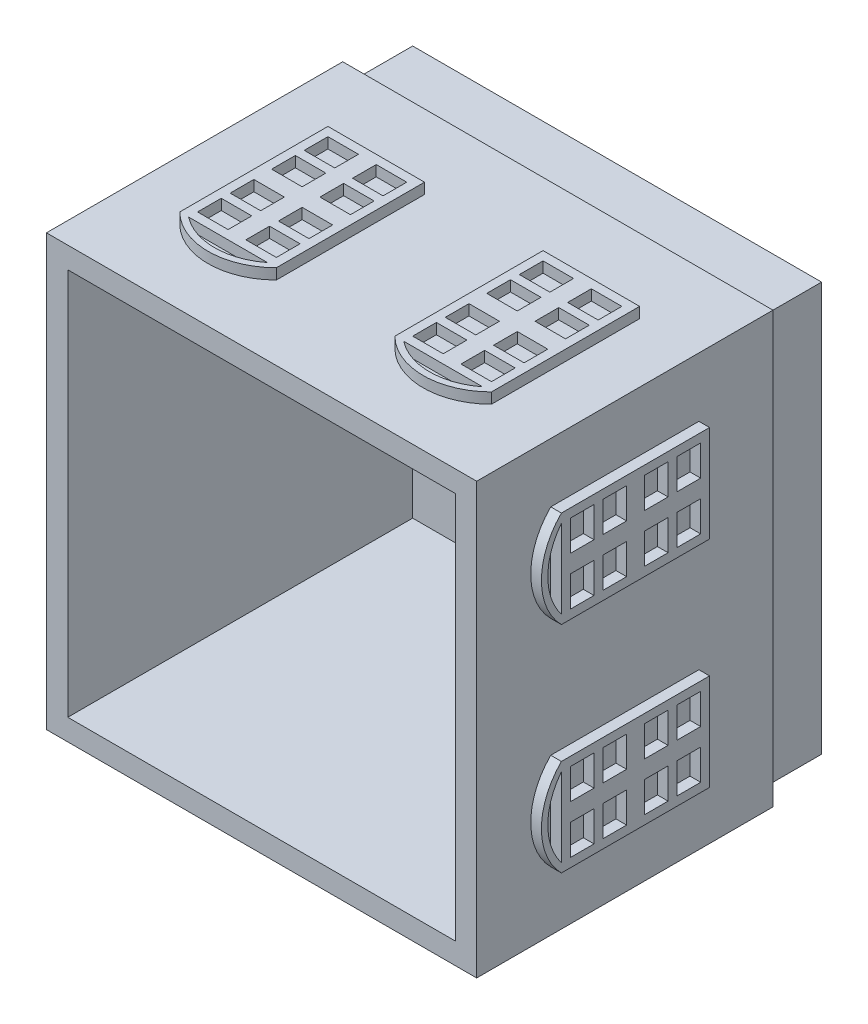
from build123d import *

# Parameters (mm, degrees)
SALIENTE_EXTRUIR1_DEPTH = 10
SALIENTE_EXTRUIR2_DEPTH = 50
CROQUIS4_W              = 5.15
CROQUIS4_H              = 4
SALIENTE_EXTRUIR3_DEPTH = 1.8
SALIENTE_EXTRUIR4_START = -16.3
SALIENTE_EXTRUIR4_DEPTH = 16.3
SALIENTE_EXTRUIR5_START = -16.3
SALIENTE_EXTRUIR5_DEPTH = 16.3
MATRIZC5_COUNT          = 4
CROQUIS16_W             = 65.4
CROQUIS16_H             = 65.4
SALIENTE_EXTRUIR6_DEPTH = 1.8


with BuildPart() as part:
    # Croquis1 → Saliente-Extruir1 (new body)
    with BuildSketch(Plane.XY):
        Polygon((-86.79550484, -42.206722689), (-88.59550484, -44.006722689), (-19.59550484, -44.006722689), (-21.39550484, -42.206722689), align=None)
    saliente_extruir1 = extrude(amount=SALIENTE_EXTRUIR1_DEPTH)

    # Croquis2 → Saliente-Extruir2 (add)
    with BuildSketch(Plane.XY.offset(10)):
        Polygon((-90.39550484, -45.806722689), (-17.79550484, -45.806722689), (-21.39550484, -42.206722689), (-86.79550484, -42.206722689), align=None)
    saliente_extruir2 = extrude(amount=SALIENTE_EXTRUIR2_DEPTH)

    # Croquis4 → Saliente-Extruir3 (add)
    # profile 1 of 2: a face of its own
    with BuildSketch(Plane.XZ.offset(45.806722689)):
        with BuildLine():
            Line((-44.09550484, 47.5), (-44.09550484, 22.5))
            Line((-44.09550484, 22.5), (-27.79550484, 22.5))
            Line((-27.79550484, 22.5), (-27.79550484, 47.5))
            ThreePointArc((-27.79550484, 47.5), (-35.94550484, 50.875840533), (-44.09550484, 47.5))
        make_face()
        with Locations((-40.02050484, 38.5)):
            Rectangle(CROQUIS4_W, CROQUIS4_H, mode=Mode.SUBTRACT)
        with Locations((-40.02050484, 44)):
            Rectangle(CROQUIS4_W, CROQUIS4_H, mode=Mode.SUBTRACT)
        with Locations((-40.02050484, 31.5)):
            Rectangle(CROQUIS4_W, CROQUIS4_H, mode=Mode.SUBTRACT)
        with Locations((-40.02050484, 26)):
            Rectangle(CROQUIS4_W, CROQUIS4_H, mode=Mode.SUBTRACT)
        with Locations((-31.87050484, 31.5)):
            Rectangle(CROQUIS4_W, CROQUIS4_H, mode=Mode.SUBTRACT)
        with Locations((-31.87050484, 26)):
            Rectangle(CROQUIS4_W, CROQUIS4_H, mode=Mode.SUBTRACT)
        with Locations((-31.87050484, 38.5)):
            Rectangle(CROQUIS4_W, CROQUIS4_H, mode=Mode.SUBTRACT)
        with Locations((-31.87050484, 44)):
            Rectangle(CROQUIS4_W, CROQUIS4_H, mode=Mode.SUBTRACT)
        with BuildLine():
            Line((-42.59550484, 47.5), (-29.29550484, 47.5))
            ThreePointArc((-29.29550484, 47.5), (-35.94550484, 49.796532913), (-42.59550484, 47.5))
        make_face(mode=Mode.SUBTRACT)
    # profile 2 of 2: a face of its own
    with BuildSketch(Plane.XZ.offset(45.806722689)):
        with BuildLine():
            Line((-80.39550484, 47.5), (-80.39550484, 22.5))
            Line((-80.39550484, 22.5), (-64.09550484, 22.5))
            Line((-64.09550484, 22.5), (-64.09550484, 47.5))
            ThreePointArc((-64.09550484, 47.5), (-72.24550484, 50.875840533), (-80.39550484, 47.5))
        make_face()
        with BuildLine():
            Line((-65.59550484, 47.5), (-78.89550484, 47.5))
            ThreePointArc((-78.89550484, 47.5), (-72.24550484, 49.796532913), (-65.59550484, 47.5))
        make_face(mode=Mode.SUBTRACT)
        with Locations((-76.32050484, 38.5)):
            Rectangle(CROQUIS4_W, CROQUIS4_H, mode=Mode.SUBTRACT)
        with Locations((-76.32050484, 44)):
            Rectangle(CROQUIS4_W, CROQUIS4_H, mode=Mode.SUBTRACT)
        with Locations((-76.32050484, 31.5)):
            Rectangle(CROQUIS4_W, CROQUIS4_H, mode=Mode.SUBTRACT)
        with Locations((-76.32050484, 26)):
            Rectangle(CROQUIS4_W, CROQUIS4_H, mode=Mode.SUBTRACT)
        with Locations((-68.17050484, 31.5)):
            Rectangle(CROQUIS4_W, CROQUIS4_H, mode=Mode.SUBTRACT)
        with Locations((-68.17050484, 26)):
            Rectangle(CROQUIS4_W, CROQUIS4_H, mode=Mode.SUBTRACT)
        with Locations((-68.17050484, 38.5)):
            Rectangle(CROQUIS4_W, CROQUIS4_H, mode=Mode.SUBTRACT)
        with Locations((-68.17050484, 44)):
            Rectangle(CROQUIS4_W, CROQUIS4_H, mode=Mode.SUBTRACT)
    saliente_extruir3 = extrude(amount=SALIENTE_EXTRUIR3_DEPTH)

    # Croquis5 → Saliente-Extruir4 (add)
    with BuildSketch(Plane(origin=(-27.79550484, 0, 0), x_dir=(0, 0, -1), z_dir=(1, 0, 0)).offset(SALIENTE_EXTRUIR4_START)):
        Polygon((-22.5, -47.606722689), (-22.5, -45.806722689), (-20.7, -45.806722689), align=None)
    extrude(amount=SALIENTE_EXTRUIR4_DEPTH)

    # Croquis14 → Saliente-Extruir5 (add)
    with BuildSketch(Plane.ZY.offset(80.39550484).offset(SALIENTE_EXTRUIR5_START)):
        Polygon((22.5, -47.606722689), (22.5, -45.806722689), (20.7, -45.806722689), align=None)
    extrude(amount=SALIENTE_EXTRUIR5_DEPTH)

    # MatrizC5: Saliente-Extruir1, Saliente-Extruir2, Saliente-Extruir3 ×4 about axis
    matrizc5_axis = Axis((-54.09550484, -9.506722689, 0), (0, 0, 1))
    add([saliente_extruir1.rotate(matrizc5_axis, i * 360 / MATRIZC5_COUNT) for i in range(1, MATRIZC5_COUNT)])
    add([saliente_extruir2.rotate(matrizc5_axis, i * 360 / MATRIZC5_COUNT) for i in range(1, MATRIZC5_COUNT)])
    add([saliente_extruir3.rotate(matrizc5_axis, i * 360 / MATRIZC5_COUNT) for i in range(1, MATRIZC5_COUNT)])

    # Croquis16 → Saliente-Extruir6 (add)
    with BuildSketch(Plane(origin=(0, 0, 0), x_dir=(-1, 0, 0), z_dir=(0, 0, -1))):
        with Locations((54.09550484, -9.506722689)):
            Rectangle(CROQUIS16_W, CROQUIS16_H)
    extrude(amount=-SALIENTE_EXTRUIR6_DEPTH)


solid = part.part
